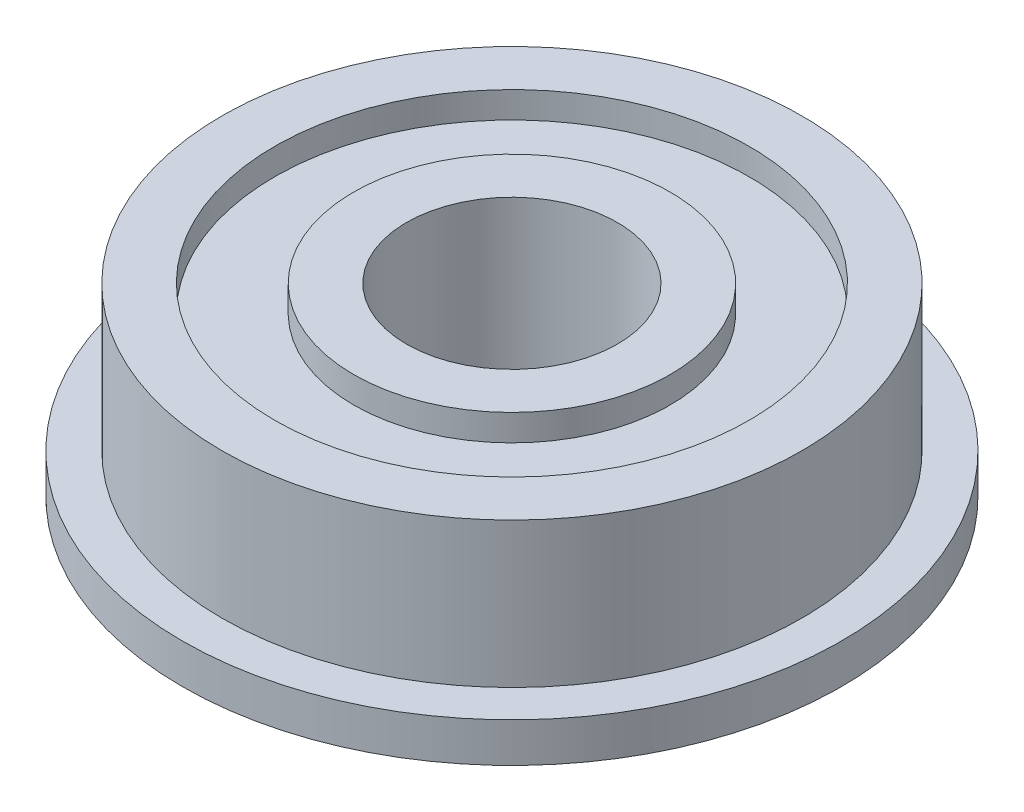
from build123d import *

# Parameters (mm, degrees)
SKETCH_1_R          = 11000
SKETCH_1_R_2        = 4000
EXTRUDE_1_DEPTH     = 7000
SKETCH_1_3_R        = 12500
SKETCH_1_3_R_2      = 11000
EXTRUDE_2_DEPTH     = 1500
SKETCH_2_R          = 9000
SKETCH_2_R_2        = 6000
CUT_EXTRUDE_1_DEPTH = 1000
CUT_EXTRUDE_START   = -1000
SKETCH_3_R          = 9000
SKETCH_3_R_2        = 6000
CUT_EXTRUDE_2_DEPTH = 1000


with BuildPart() as part:
    # 草圖1 → 填料-伸長1 (new body)
    with BuildSketch(Plane(origin=(0, 0, 0), x_dir=(1, 0, 0), z_dir=(0, 1, 0))):
        Circle(SKETCH_1_R)
        Circle(SKETCH_1_R_2, mode=Mode.SUBTRACT)
    extrude(amount=EXTRUDE_1_DEPTH)

    # 草圖1<3> → 填料-伸長2 (add)
    with BuildSketch(Plane(origin=(0, 0, 0), x_dir=(1, 0, 0), z_dir=(0, 1, 0))):
        Circle(SKETCH_1_3_R)
        Circle(SKETCH_1_3_R_2, mode=Mode.SUBTRACT)
    extrude(amount=EXTRUDE_2_DEPTH)

    # 草圖2 → 除料-伸長1 (cut)
    with BuildSketch(Plane(origin=(0, 7000, 0), x_dir=(1, 0, 0), z_dir=(0, 1, 0))):
        Circle(SKETCH_2_R)
        Circle(SKETCH_2_R_2, mode=Mode.SUBTRACT)
    extrude(amount=-CUT_EXTRUDE_1_DEPTH, mode=Mode.SUBTRACT)

    # 草圖3 → 除料-伸長2 (cut)
    with BuildSketch(Plane.XZ.offset(CUT_EXTRUDE_START)):
        Circle(SKETCH_3_R)
        Circle(SKETCH_3_R_2, mode=Mode.SUBTRACT)
    extrude(amount=CUT_EXTRUDE_2_DEPTH, mode=Mode.SUBTRACT)


solid = part.part
